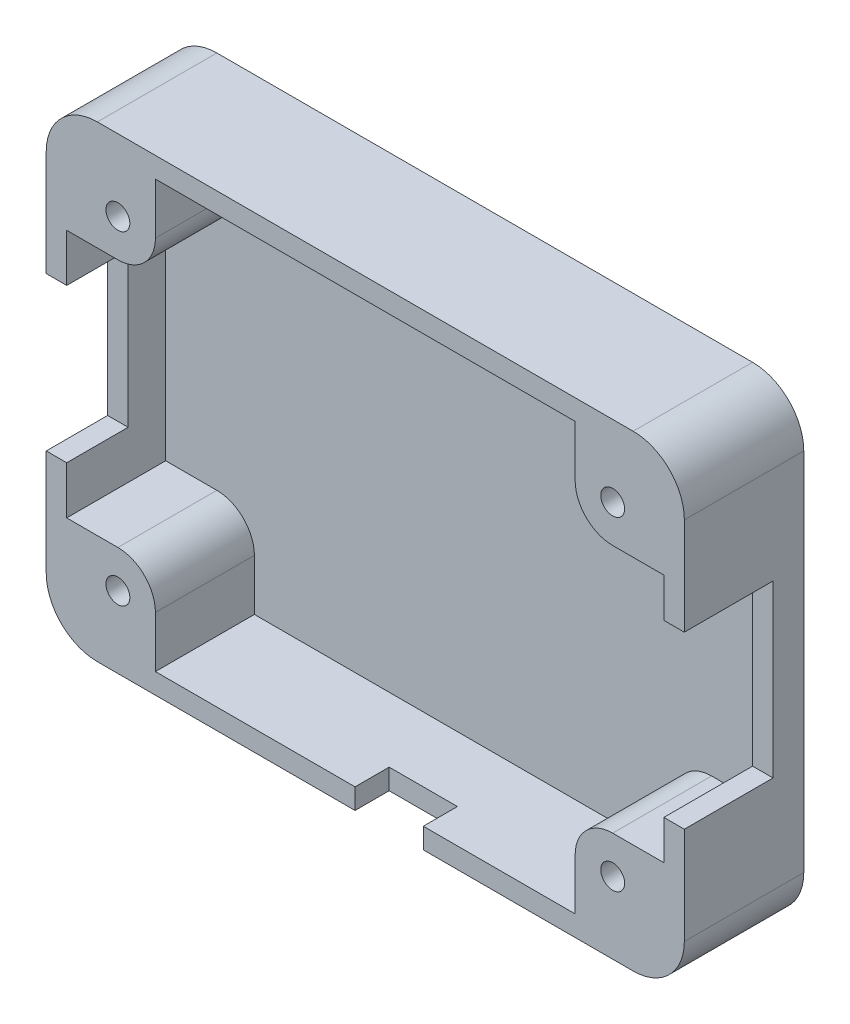
from build123d import *

# Parameters (mm, degrees)
SKETCH_1_W          = 37.4
SKETCH_1_H          = 27.4
EXTRUDE_1_DEPTH     = 7
SHELL_1_T           = -1.2
SKETCH_3_W          = 2
SKETCH_3_H          = 9
CUT_EXTRUDE_1_DEPTH = 3.6
SKETCH_4_W          = 2
SKETCH_4_H          = 10
CUT_EXTRUDE_2_DEPTH = 5.2
SKETCH_5_W          = 4
SKETCH_5_H          = 2
CUT_EXTRUDE_3_DEPTH = 2
SKETCH_6_R          = 0.7
EXTRUDE_2_DEPTH     = 5.8
FILLET_1_R          = 3


with BuildPart() as part:
    # 草图1 → 凸台-拉伸1 (new body)
    with BuildSketch(Plane.XY):
        Rectangle(SKETCH_1_W, SKETCH_1_H)
    extrude(amount=EXTRUDE_1_DEPTH)

    # 抽壳1
    shell_1_openings = [part.faces().sort_by_distance(p)[0] for p in [
        (0, 0, 7),
    ]]
    offset(amount=SHELL_1_T, openings=shell_1_openings, kind=Kind.INTERSECTION)

    # 草图3 → 切除-拉伸1 (cut)
    with BuildSketch(Plane.XY.offset(7)):
        with Locations((-18.02869535, 0)):
            Rectangle(SKETCH_3_W, SKETCH_3_H)
    extrude(amount=-CUT_EXTRUDE_1_DEPTH, mode=Mode.SUBTRACT)

    # 草图4 → 切除-拉伸2 (cut)
    with BuildSketch(Plane.XY.offset(7)):
        with Locations((18.188969671, 0)):
            Rectangle(SKETCH_4_W, SKETCH_4_H)
    extrude(amount=-CUT_EXTRUDE_2_DEPTH, mode=Mode.SUBTRACT)

    # 草图5 → 切除-拉伸3 (cut)
    with BuildSketch(Plane.XY.offset(7)):
        with Locations((1.4, -13.132972029)):
            Rectangle(SKETCH_5_W, SKETCH_5_H)
    extrude(amount=-CUT_EXTRUDE_3_DEPTH, mode=Mode.SUBTRACT)

    # 草图6 → 凸台-拉伸2 (add)
    # profile 1 of 4: a face of its own
    with BuildSketch(Plane.XY.offset(1.2)):
        with BuildLine():
            Line((14.5, -7.3), (17.5, -7.3))
            Line((17.5, -7.3), (17.5, -12.5))
            Line((17.5, -12.5), (12.3, -12.5))
            Line((12.3, -12.5), (12.3, -9.5))
            ThreePointArc((12.3, -9.5), (12.944365081, -7.944365081), (14.5, -7.3))
        make_face()
        with Locations((14.5, -9.5)):
            Circle(SKETCH_6_R, mode=Mode.SUBTRACT)
    # profile 2 of 4: a face of its own
    with BuildSketch(Plane.XY.offset(1.2)):
        with BuildLine():
            Line((-12.3, -12.5), (-17.5, -12.5))
            Line((-17.5, -12.5), (-17.5, -7.3))
            Line((-17.5, -7.3), (-14.5, -7.3))
            ThreePointArc((-14.5, -7.3), (-12.944365081, -7.944365081), (-12.3, -9.5))
            Line((-12.3, -9.5), (-12.3, -12.5))
        make_face()
        with Locations((-14.5, -9.5)):
            Circle(SKETCH_6_R, mode=Mode.SUBTRACT)
    # profile 3 of 4: a face of its own
    with BuildSketch(Plane.XY.offset(1.2)):
        with BuildLine():
            Line((-17.5, 12.5), (-17.5, 7.3))
            Line((-17.5, 7.3), (-14.5, 7.3))
            ThreePointArc((-14.5, 7.3), (-12.944365081, 7.944365081), (-12.3, 9.5))
            Line((-12.3, 9.5), (-12.3, 12.5))
            Line((-12.3, 12.5), (-17.5, 12.5))
        make_face()
        with Locations((-14.5, 9.5)):
            Circle(SKETCH_6_R, mode=Mode.SUBTRACT)
    # profile 4 of 4: a face of its own
    with BuildSketch(Plane.XY.offset(1.2)):
        with BuildLine():
            Line((17.5, 12.5), (17.5, 7.3))
            Line((17.5, 7.3), (14.5, 7.3))
            ThreePointArc((14.5, 7.3), (12.944365081, 7.944365081), (12.3, 9.5))
            Line((12.3, 9.5), (12.3, 12.5))
            Line((12.3, 12.5), (17.5, 12.5))
        make_face()
        with Locations((14.5, 9.5)):
            Circle(SKETCH_6_R, mode=Mode.SUBTRACT)
    extrude(amount=EXTRUDE_2_DEPTH)

    # 圆角1
    fillet_1_edges = [part.edges().sort_by_distance(p)[0] for p in [
        (18.7, -13.7, 3.5),
        (-18.7, -13.7, 3.5),
        (-18.7, 13.7, 3.5),
        (18.7, 13.7, 3.5),
    ]]
    fillet(fillet_1_edges, radius=FILLET_1_R)


solid = part.part
